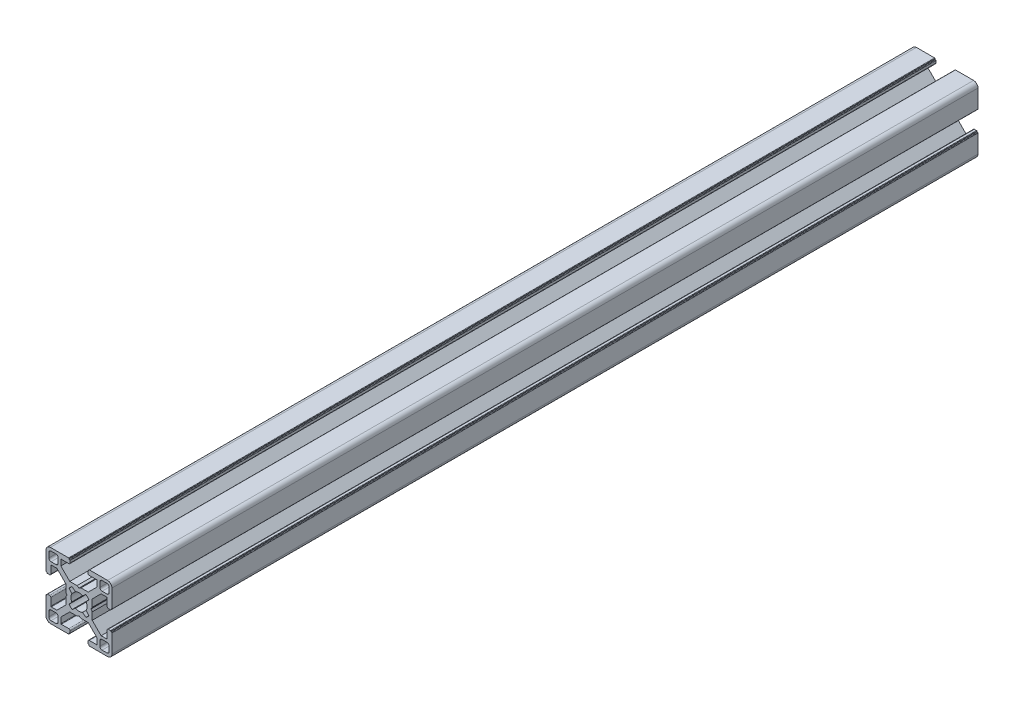
from build123d import *

# Parameters (mm, degrees)
BOSS_EXTRUDE1_DEPTH = 393.7


with BuildPart() as part:
    # Sketch1 → Boss-Extrude1 (new body)
    with BuildSketch(Plane.XY):
        with BuildLine():
            Line((6.00446543, 0.899999619), (5.484852164, 0))
            Line((5.484852164, 0), (6.00446543, -0.899999619))
            Line((6.00446543, -0.899999619), (6.00446543, -4.204465866))
            Line((6.00446543, -4.204465866), (10.049999564, -8.25))
            Line((10.049999564, -8.25), (12.59999928, -8.25))
            ThreePointArc((12.59999928, -8.25), (12.741420837, -8.191421273), (12.799999564, -8.049999716))
            Line((12.799999564, -8.049999716), (12.799999564, -4.649999613))
            ThreePointArc((12.799999564, -4.649999613), (12.975735606, -4.225735278), (13.39999994, -4.049999237))
            Line((13.39999994, -4.049999237), (14.300000043, -4.049999237))
            ThreePointArc((14.300000043, -4.049999237), (14.4414216, -4.108577964), (14.500000327, -4.249999521))
            Line((14.500000327, -4.249999521), (14.500000327, -4.349998953))
            ThreePointArc((14.500000327, -4.349998953), (14.558579054, -4.49142051), (14.700000611, -4.549999237))
            Line((14.700000611, -4.549999237), (14.799999716, -4.549999237))
            ThreePointArc((14.799999716, -4.549999237), (14.941421273, -4.608577964), (15, -4.749999521))
            Line((15, -4.749999521), (15, -13.000000346))
            ThreePointArc((15, -13.000000346), (14.414213664, -14.414213664), (13.000000346, -15))
            Line((13.000000346, -15), (4.749999945, -15))
            ThreePointArc((4.749999945, -15), (4.60857832, -14.941421245), (4.549999564, -14.799999619))
            Line((4.549999564, -14.799999619), (4.549999564, -14.69999942))
            ThreePointArc((4.549999564, -14.69999942), (4.49142109, -14.558578474), (4.350000144, -14.5))
            Line((4.350000144, -14.5), (4.250000374, -14.5))
            ThreePointArc((4.250000374, -14.5), (4.108578753, -14.441421247), (4.05, -14.299999626))
            Line((4.05, -14.299999626), (4.05, -13.399999434))
            ThreePointArc((4.05, -13.399999434), (4.225735989, -12.975735226), (4.650000197, -12.799999237))
            Line((4.650000197, -12.799999237), (8.049999924, -12.799999237))
            ThreePointArc((8.049999924, -12.799999237), (8.191421565, -12.741420475), (8.250000327, -12.599998834))
            Line((8.250000327, -12.599998834), (8.250000327, -10.049999237))
            Line((8.250000327, -10.049999237), (4.204466193, -6))
            Line((4.204466193, -6), (0.899999946, -6))
            Line((0.899999946, -6), (0, -5.484851837))
            Line((0, -5.484851837), (-0.899999946, -6))
            Line((-0.899999946, -6), (-4.204466193, -6))
            Line((-4.204466193, -6), (-8.250000327, -10.049999237))
            Line((-8.250000327, -10.049999237), (-8.250000327, -12.599998834))
            ThreePointArc((-8.250000327, -12.599998834), (-8.191421565, -12.741420475), (-8.049999924, -12.799999237))
            Line((-8.049999924, -12.799999237), (-4.650000197, -12.799999237))
            ThreePointArc((-4.650000197, -12.799999237), (-4.225735989, -12.975735226), (-4.05, -13.399999434))
            Line((-4.05, -13.399999434), (-4.05, -14.299999626))
            ThreePointArc((-4.05, -14.299999626), (-4.108578753, -14.441421247), (-4.250000374, -14.5))
            Line((-4.250000374, -14.5), (-4.350000144, -14.5))
            ThreePointArc((-4.350000144, -14.5), (-4.49142109, -14.558578474), (-4.549999564, -14.69999942))
            Line((-4.549999564, -14.69999942), (-4.549999564, -14.799999619))
            ThreePointArc((-4.549999564, -14.799999619), (-4.60857832, -14.941421245), (-4.749999945, -15))
            Line((-4.749999945, -15), (-13.000000346, -15))
            ThreePointArc((-13.000000346, -15), (-14.414213664, -14.414213664), (-15, -13.000000346))
            Line((-15, -13.000000346), (-15, -4.749999521))
            ThreePointArc((-15, -4.749999521), (-14.941421273, -4.608577964), (-14.799999716, -4.549999237))
            Line((-14.799999716, -4.549999237), (-14.700000611, -4.549999237))
            ThreePointArc((-14.700000611, -4.549999237), (-14.558579054, -4.49142051), (-14.500000327, -4.349998953))
            Line((-14.500000327, -4.349998953), (-14.500000327, -4.249999521))
            ThreePointArc((-14.500000327, -4.249999521), (-14.4414216, -4.108577964), (-14.300000043, -4.049999237))
            Line((-14.300000043, -4.049999237), (-13.39999994, -4.049999237))
            ThreePointArc((-13.39999994, -4.049999237), (-12.975735606, -4.225735278), (-12.799999564, -4.649999613))
            Line((-12.799999564, -4.649999613), (-12.799999564, -8.049999716))
            ThreePointArc((-12.799999564, -8.049999716), (-12.741420837, -8.191421273), (-12.59999928, -8.25))
            Line((-12.59999928, -8.25), (-10.049999564, -8.25))
            Line((-10.049999564, -8.25), (-6.00446543, -4.204465866))
            Line((-6.00446543, -4.204465866), (-6.00446543, -0.899999619))
            Line((-6.00446543, -0.899999619), (-5.484852164, 0))
            Line((-5.484852164, 0), (-6.00446543, 0.899999619))
            Line((-6.00446543, 0.899999619), (-6.00446543, 4.204465866))
            Line((-6.00446543, 4.204465866), (-10.049999564, 8.25))
            Line((-10.049999564, 8.25), (-12.59999928, 8.25))
            ThreePointArc((-12.59999928, 8.25), (-12.741420837, 8.191421273), (-12.799999564, 8.049999716))
            Line((-12.799999564, 8.049999716), (-12.799999564, 4.649999613))
            ThreePointArc((-12.799999564, 4.649999613), (-12.975735606, 4.225735278), (-13.39999994, 4.049999237))
            Line((-13.39999994, 4.049999237), (-14.300000043, 4.049999237))
            ThreePointArc((-14.300000043, 4.049999237), (-14.4414216, 4.108577964), (-14.500000327, 4.249999521))
            Line((-14.500000327, 4.249999521), (-14.500000327, 4.349998953))
            ThreePointArc((-14.500000327, 4.349998953), (-14.558579054, 4.49142051), (-14.700000611, 4.549999237))
            Line((-14.700000611, 4.549999237), (-14.799999716, 4.549999237))
            ThreePointArc((-14.799999716, 4.549999237), (-14.941421273, 4.608577964), (-15, 4.749999521))
            Line((-15, 4.749999521), (-15, 13.000000346))
            ThreePointArc((-15, 13.000000346), (-14.414213664, 14.414213664), (-13.000000346, 15))
            Line((-13.000000346, 15), (-4.749999945, 15))
            ThreePointArc((-4.749999945, 15), (-4.60857832, 14.941421245), (-4.549999564, 14.799999619))
            Line((-4.549999564, 14.799999619), (-4.549999564, 14.69999942))
            ThreePointArc((-4.549999564, 14.69999942), (-4.49142109, 14.558578474), (-4.350000144, 14.5))
            Line((-4.350000144, 14.5), (-4.250000374, 14.5))
            ThreePointArc((-4.250000374, 14.5), (-4.108578753, 14.441421247), (-4.05, 14.299999626))
            Line((-4.05, 14.299999626), (-4.05, 13.399999434))
            ThreePointArc((-4.05, 13.399999434), (-4.225735989, 12.975735226), (-4.650000197, 12.799999237))
            Line((-4.650000197, 12.799999237), (-8.049999924, 12.799999237))
            ThreePointArc((-8.049999924, 12.799999237), (-8.191421565, 12.741420475), (-8.250000327, 12.599998834))
            Line((-8.250000327, 12.599998834), (-8.250000327, 10.049999237))
            Line((-8.250000327, 10.049999237), (-4.204466193, 6))
            Line((-4.204466193, 6), (-0.899999946, 6))
            Line((-0.899999946, 6), (0, 5.484851837))
            Line((0, 5.484851837), (0.899999946, 6))
            Line((0.899999946, 6), (4.204466193, 6))
            Line((4.204466193, 6), (8.250000327, 10.049999237))
            Line((8.250000327, 10.049999237), (8.250000327, 12.599998834))
            ThreePointArc((8.250000327, 12.599998834), (8.191421565, 12.741420475), (8.049999924, 12.799999237))
            Line((8.049999924, 12.799999237), (4.650000197, 12.799999237))
            ThreePointArc((4.650000197, 12.799999237), (4.225735989, 12.975735226), (4.05, 13.399999434))
            Line((4.05, 13.399999434), (4.05, 14.299999626))
            ThreePointArc((4.05, 14.299999626), (4.108578753, 14.441421247), (4.250000374, 14.5))
            Line((4.250000374, 14.5), (4.350000144, 14.5))
            ThreePointArc((4.350000144, 14.5), (4.49142109, 14.558578474), (4.549999564, 14.69999942))
            Line((4.549999564, 14.69999942), (4.549999564, 14.799999619))
            ThreePointArc((4.549999564, 14.799999619), (4.60857832, 14.941421245), (4.749999945, 15))
            Line((4.749999945, 15), (13.000000346, 15))
            ThreePointArc((13.000000346, 15), (14.414213664, 14.414213664), (15, 13.000000346))
            Line((15, 13.000000346), (15, 4.749999521))
            ThreePointArc((15, 4.749999521), (14.941421273, 4.608577964), (14.799999716, 4.549999237))
            Line((14.799999716, 4.549999237), (14.700000611, 4.549999237))
            ThreePointArc((14.700000611, 4.549999237), (14.558579054, 4.49142051), (14.500000327, 4.349998953))
            Line((14.500000327, 4.349998953), (14.500000327, 4.249999521))
            ThreePointArc((14.500000327, 4.249999521), (14.4414216, 4.108577964), (14.300000043, 4.049999237))
            Line((14.300000043, 4.049999237), (13.39999994, 4.049999237))
            ThreePointArc((13.39999994, 4.049999237), (12.975735606, 4.225735278), (12.799999564, 4.649999613))
            Line((12.799999564, 4.649999613), (12.799999564, 8.049999716))
            ThreePointArc((12.799999564, 8.049999716), (12.741420837, 8.191421273), (12.59999928, 8.25))
            Line((12.59999928, 8.25), (10.049999564, 8.25))
            Line((10.049999564, 8.25), (6.00446543, 4.204465866))
            Line((6.00446543, 4.204465866), (6.00446543, 0.899999619))
        make_face()
        with BuildLine():
            Line((13.70000109, 12.700000398), (13.70000109, 10.499999635))
            ThreePointArc((13.70000109, 10.499999635), (13.407107874, 9.792892851), (12.70000109, 9.499999635))
            Line((12.70000109, 9.499999635), (10.500000327, 9.499999635))
            ThreePointArc((10.500000327, 9.499999635), (9.792893543, 9.792892851), (9.500000327, 10.499999635))
            Line((9.500000327, 10.499999635), (9.500000327, 12.700000398))
            ThreePointArc((9.500000327, 12.700000398), (9.792893543, 13.407107182), (10.500000327, 13.700000398))
            Line((10.500000327, 13.700000398), (12.70000109, 13.700000398))
            ThreePointArc((12.70000109, 13.700000398), (13.407107874, 13.407107182), (13.70000109, 12.700000398))
        make_face(mode=Mode.SUBTRACT)
        with BuildLine():
            Line((3.135929412, 4.518400903), (1.600129524, 3.280561767))
            ThreePointArc((1.600129524, 3.280561767), (0, 3.65), (-1.600129524, 3.280561767))
            Line((-1.600129524, 3.280561767), (-3.135929412, 4.518400903))
            ThreePointArc((-3.135929412, 4.518400903), (-3.881002259, 3.897155561), (-4.505336892, 3.154669473))
            Line((-4.505336892, 3.154669473), (-3.280561732, 1.600129597))
            ThreePointArc((-3.280561732, 1.600129597), (-3.65, 0), (-3.280561732, -1.600129597))
            Line((-3.280561732, -1.600129597), (-4.505336892, -3.154669473))
            ThreePointArc((-4.505336892, -3.154669473), (-3.881002259, -3.897155561), (-3.135929412, -4.518400903))
            Line((-3.135929412, -4.518400903), (-1.600129524, -3.280561767))
            ThreePointArc((-1.600129524, -3.280561767), (0, -3.65), (1.600129524, -3.280561767))
            Line((1.600129524, -3.280561767), (3.135929412, -4.518400903))
            ThreePointArc((3.135929412, -4.518400903), (3.881002259, -3.897155561), (4.505336892, -3.154669473))
            Line((4.505336892, -3.154669473), (3.280561732, -1.600129597))
            ThreePointArc((3.280561732, -1.600129597), (3.65, 0), (3.280561732, 1.600129597))
            Line((3.280561732, 1.600129597), (4.505336892, 3.154669473))
            ThreePointArc((4.505336892, 3.154669473), (3.881002259, 3.897155561), (3.135929412, 4.518400903))
        make_face(mode=Mode.SUBTRACT)
        with BuildLine():
            Line((-13.70000109, -12.700000398), (-13.70000109, -10.499999635))
            ThreePointArc((-13.70000109, -10.499999635), (-13.407107874, -9.792892851), (-12.70000109, -9.499999635))
            Line((-12.70000109, -9.499999635), (-10.500000327, -9.499999635))
            ThreePointArc((-10.500000327, -9.499999635), (-9.792893543, -9.792892851), (-9.500000327, -10.499999635))
            Line((-9.500000327, -10.499999635), (-9.500000327, -12.700000398))
            ThreePointArc((-9.500000327, -12.700000398), (-9.792893543, -13.407107182), (-10.500000327, -13.700000398))
            Line((-10.500000327, -13.700000398), (-12.70000109, -13.700000398))
            ThreePointArc((-12.70000109, -13.700000398), (-13.407107874, -13.407107182), (-13.70000109, -12.700000398))
        make_face(mode=Mode.SUBTRACT)
        with BuildLine():
            Line((10.500000327, -13.700000398), (12.70000109, -13.700000398))
            ThreePointArc((12.70000109, -13.700000398), (13.407107874, -13.407107182), (13.70000109, -12.700000398))
            Line((13.70000109, -12.700000398), (13.70000109, -10.499999635))
            ThreePointArc((13.70000109, -10.499999635), (13.407107874, -9.792892851), (12.70000109, -9.499999635))
            Line((12.70000109, -9.499999635), (10.500000327, -9.499999635))
            ThreePointArc((10.500000327, -9.499999635), (9.792893543, -9.792892851), (9.500000327, -10.499999635))
            Line((9.500000327, -10.499999635), (9.500000327, -12.700000398))
            ThreePointArc((9.500000327, -12.700000398), (9.792893543, -13.407107182), (10.500000327, -13.700000398))
        make_face(mode=Mode.SUBTRACT)
        with BuildLine():
            Line((-10.500000327, 13.700000398), (-12.70000109, 13.700000398))
            ThreePointArc((-12.70000109, 13.700000398), (-13.407107874, 13.407107182), (-13.70000109, 12.700000398))
            Line((-13.70000109, 12.700000398), (-13.70000109, 10.499999635))
            ThreePointArc((-13.70000109, 10.499999635), (-13.407107874, 9.792892851), (-12.70000109, 9.499999635))
            Line((-12.70000109, 9.499999635), (-10.500000327, 9.499999635))
            ThreePointArc((-10.500000327, 9.499999635), (-9.792893543, 9.792892851), (-9.500000327, 10.499999635))
            Line((-9.500000327, 10.499999635), (-9.500000327, 12.700000398))
            ThreePointArc((-9.500000327, 12.700000398), (-9.792893543, 13.407107182), (-10.500000327, 13.700000398))
        make_face(mode=Mode.SUBTRACT)
    extrude(amount=BOSS_EXTRUDE1_DEPTH)


solid = part.part
